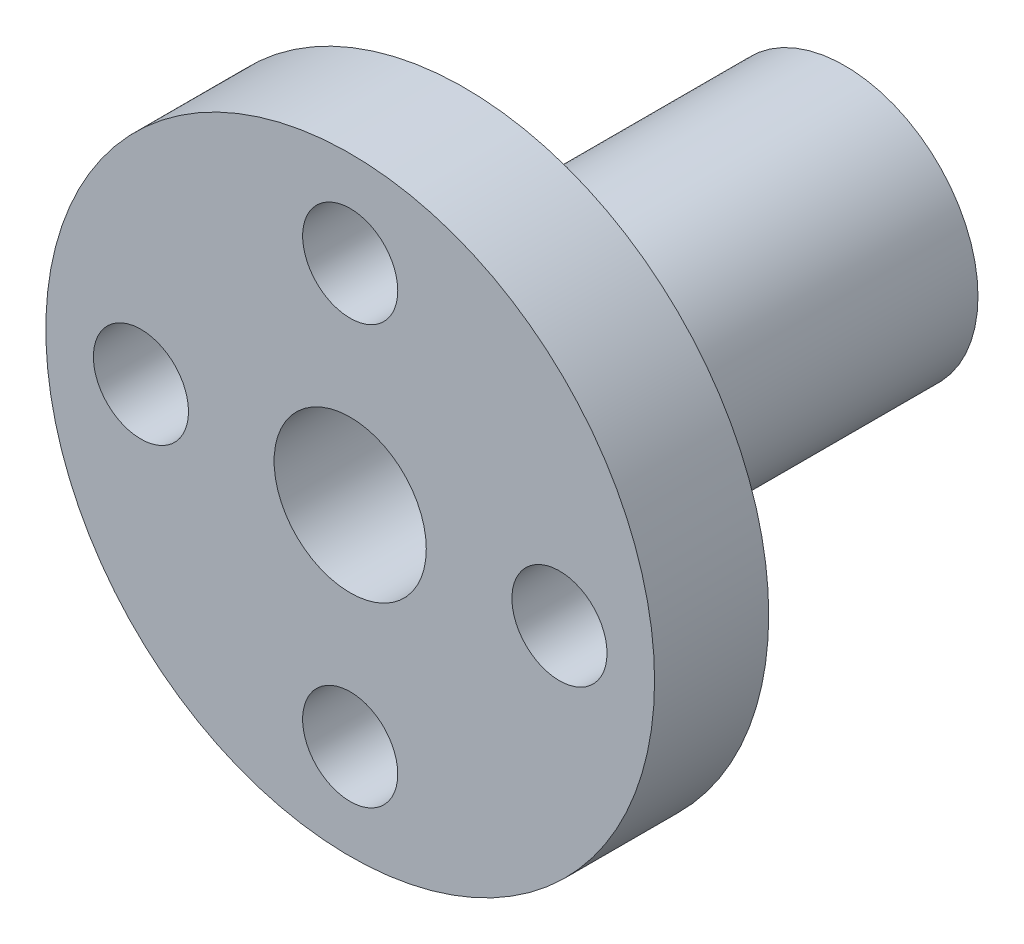
from build123d import *

# Parameters (mm, degrees)
SKETCH1_R           = 8
SKETCH1_R_2         = 1.25
BOSS_EXTRUDE1_DEPTH = 3
SKETCH2_R           = 3.5
BOSS_EXTRUDE2_DEPTH = 10
SKETCH3_R           = 2
CUT_EXTRUDE1_DEPTH  = 18.23368794


with BuildPart() as part:
    # Sketch1 → Boss-Extrude1 (new body)
    with BuildSketch(Plane.XY):
        Circle(SKETCH1_R)
        with Locations((0, 5.5)):
            Circle(SKETCH1_R_2, mode=Mode.SUBTRACT)
        with Locations((5.5, 0)):
            Circle(SKETCH1_R_2, mode=Mode.SUBTRACT)
        with Locations((0, -5.5)):
            Circle(SKETCH1_R_2, mode=Mode.SUBTRACT)
        with Locations((-5.5, 0)):
            Circle(SKETCH1_R_2, mode=Mode.SUBTRACT)
    extrude(amount=BOSS_EXTRUDE1_DEPTH)

    # Sketch2 → Boss-Extrude2 (add)
    with BuildSketch(Plane.XY):
        Circle(SKETCH2_R)
    extrude(amount=-BOSS_EXTRUDE2_DEPTH)

    # Sketch3 → Cut-Extrude1 (cut, through all)
    with BuildSketch(Plane.XY.offset(3)):
        Circle(SKETCH3_R)
    extrude(amount=-CUT_EXTRUDE1_DEPTH, mode=Mode.SUBTRACT)


solid = part.part
